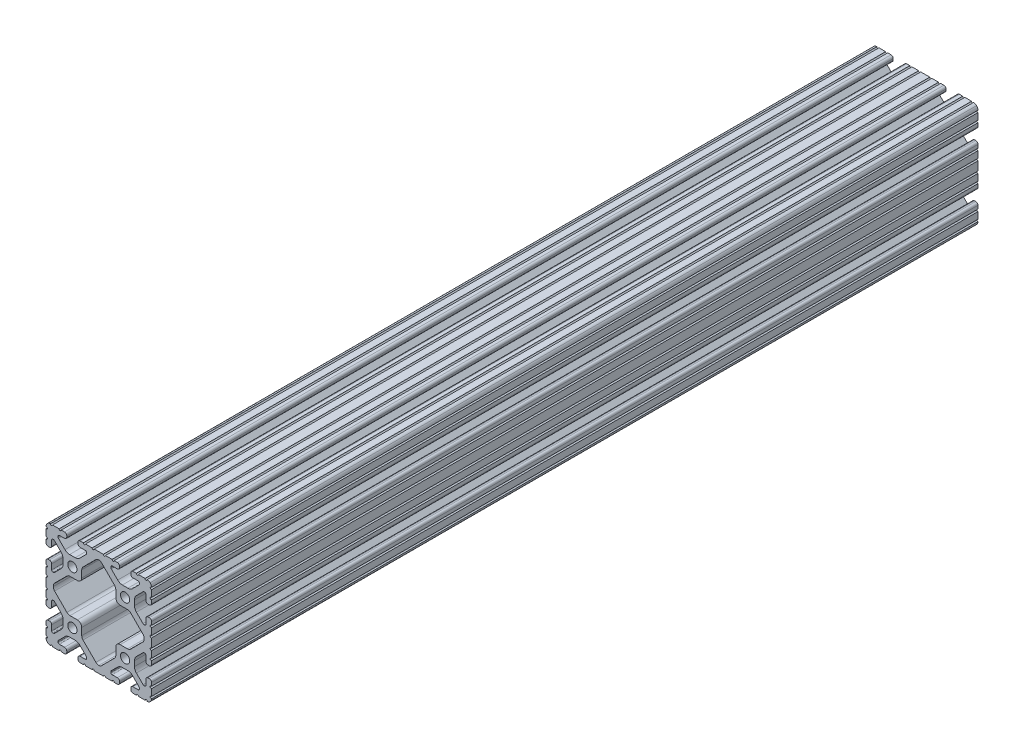
from build123d import *

# Parameters (mm, degrees)
SKETCH1_R           = 3.3274
BOSS_EXTRUDE1_DEPTH = 298.45


with BuildPart() as part:
    # Sketch1 → Boss-Extrude1 (new, symmetric)
    with BuildSketch(Plane.XY):
        with BuildLine():
            Line((-4.777313069, 38.1), (-9.605274992, 38.1))
            ThreePointArc((-9.605274992, 38.1), (-10.367071033, 37.320370693), (-11.128867074, 38.1))
            Line((-11.128867074, 38.1), (-13.4112, 38.1))
            ThreePointArc((-13.4112, 38.1), (-14.524751759, 37.638751759), (-14.986, 36.5252))
            Line((-14.986, 36.5252), (-14.986, 35.6108))
            ThreePointArc((-14.986, 35.6108), (-14.524751759, 34.497248241), (-13.4112, 34.036))
            Line((-13.4112, 34.036), (-9.652, 34.036))
            ThreePointArc((-9.652, 34.036), (-9.023382072, 33.775617928), (-8.763, 33.147))
            Line((-8.763, 33.147), (-8.763, 32.493548179))
            ThreePointArc((-8.763, 32.493548179), (-8.830670886, 32.153343113), (-9.023381298, 31.864931024))
            Line((-9.023381298, 31.864931024), (-13.690712501, 27.197588341))
            ThreePointArc((-13.690712501, 27.197588341), (-15.231659955, 26.167958114), (-17.049332421, 25.8064))
            Line((-17.049332421, 25.8064), (-21.050667579, 25.8064))
            ThreePointArc((-21.050667579, 25.8064), (-22.868340045, 26.167958114), (-24.409287499, 27.197588341))
            Line((-24.409287499, 27.197588341), (-29.100231244, 31.888543625))
            ThreePointArc((-29.100231244, 31.888543625), (-29.326675076, 32.273872751), (-29.337, 32.720693454))
            Line((-29.337, 32.720693454), (-29.337, 33.147))
            ThreePointArc((-29.337, 33.147), (-29.076617928, 33.775617928), (-28.448, 34.036))
            Line((-28.448, 34.036), (-24.6888, 34.036))
            ThreePointArc((-24.6888, 34.036), (-23.575248241, 34.497248241), (-23.114, 35.6108))
            Line((-23.114, 35.6108), (-23.114, 36.5252))
            ThreePointArc((-23.114, 36.5252), (-23.575248241, 37.638751759), (-24.6888, 38.1))
            Line((-24.6888, 38.1), (-27.077211227, 38.1))
            ThreePointArc((-27.077211227, 38.1), (-27.839158581, 37.32021942), (-28.601105935, 38.1))
            Line((-28.601105935, 38.1), (-33.428778994, 38.1))
            ThreePointArc((-33.428778994, 38.1), (-34.190730434, 37.320215335), (-34.952681874, 38.1))
            ThreePointArc((-34.952681874, 38.1), (-36.106286572, 37.843374398), (-37.086123144, 37.182631793))
            ThreePointArc((-37.086123144, 37.182631793), (-37.837757813, 36.120195002), (-38.1, 34.845457521))
            ThreePointArc((-38.1, 34.845457521), (-37.141472621, 34.109236774), (-38.1, 33.373016026))
            Line((-38.1, 33.373016026), (-38.1, 28.545258062))
            ThreePointArc((-38.1, 28.545258062), (-37.117780706, 27.7845421), (-38.1, 27.023826138))
            Line((-38.1, 27.023826138), (-38.1, 24.630195866))
            ThreePointArc((-38.1, 24.630195866), (-37.638751813, 23.516644236), (-36.525200183, 23.055396049))
            Line((-36.525200183, 23.055396049), (-35.6108, 23.055396049))
            ThreePointArc((-35.6108, 23.055396049), (-34.497248241, 23.51664429), (-34.036, 24.630196049))
            Line((-34.036, 24.630196049), (-34.036, 28.448))
            ThreePointArc((-34.036, 28.448), (-33.775617928, 29.076617928), (-33.147, 29.337))
            Line((-33.147, 29.337), (-32.664287242, 29.337))
            ThreePointArc((-32.664287242, 29.337), (-32.324081166, 29.269328695), (-32.03566854, 29.076617155))
            Line((-32.03566854, 29.076617155), (-27.19758008, 24.238516795))
            ThreePointArc((-27.19758008, 24.238516795), (-26.167955879, 22.697572205), (-25.8064, 20.879905136))
            Line((-25.8064, 20.879905136), (-25.8064, 17.220094864))
            ThreePointArc((-25.8064, 17.220094864), (-26.167955879, 15.402427795), (-27.19758008, 13.861483205))
            Line((-27.19758008, 13.861483205), (-31.948944541, 9.110107057))
            ThreePointArc((-31.948944541, 9.110107057), (-32.333417096, 8.853210196), (-32.786933649, 8.763))
            Line((-32.786933649, 8.763), (-33.060275787, 8.763))
            ThreePointArc((-33.060275787, 8.763), (-33.750216995, 9.048783005), (-34.036, 9.738724213))
            Line((-34.036, 9.738724213), (-34.036, 13.469803585))
            ThreePointArc((-34.036, 13.469803585), (-34.497248348, 14.583355603), (-35.610800366, 15.044603951))
            Line((-35.610800366, 15.044603951), (-36.5252, 15.044603951))
            ThreePointArc((-36.5252, 15.044603951), (-37.638751759, 14.58335571), (-38.1, 13.469803951))
            Line((-38.1, 13.469803951), (-38.1, 11.075039289))
            ThreePointArc((-38.1, 11.075039289), (-37.117000248, 10.313517272), (-38.1, 9.551995255))
            Line((-38.1, 9.551995255), (-38.1, 4.723759308))
            ThreePointArc((-38.1, 4.723759308), (-37.117000248, 3.962237292), (-38.1, 3.200715275))
            Line((-38.1, 3.200715275), (-38.1, -3.200715275))
            ThreePointArc((-38.1, -3.200715275), (-37.117000248, -3.962237292), (-38.1, -4.723759308))
            Line((-38.1, -4.723759308), (-38.1, -9.551995255))
            ThreePointArc((-38.1, -9.551995255), (-37.117000248, -10.313517272), (-38.1, -11.075039289))
            Line((-38.1, -11.075039289), (-38.1, -13.469803951))
            ThreePointArc((-38.1, -13.469803951), (-37.638751759, -14.58335571), (-36.5252, -15.044603951))
            Line((-36.5252, -15.044603951), (-35.610800366, -15.044603951))
            ThreePointArc((-35.610800366, -15.044603951), (-34.497248348, -14.583355603), (-34.036, -13.469803585))
            Line((-34.036, -13.469803585), (-34.036, -9.738724213))
            ThreePointArc((-34.036, -9.738724213), (-33.750216995, -9.048783005), (-33.060275787, -8.763))
            Line((-33.060275787, -8.763), (-32.786933649, -8.763))
            ThreePointArc((-32.786933649, -8.763), (-32.333417096, -8.853210196), (-31.948944541, -9.110107057))
            Line((-31.948944541, -9.110107057), (-27.19758008, -13.861483205))
            ThreePointArc((-27.19758008, -13.861483205), (-26.167955879, -15.402427795), (-25.8064, -17.220094864))
            Line((-25.8064, -17.220094864), (-25.8064, -20.879905136))
            ThreePointArc((-25.8064, -20.879905136), (-26.167955879, -22.697572205), (-27.19758008, -24.238516795))
            Line((-27.19758008, -24.238516795), (-32.03566854, -29.076617155))
            ThreePointArc((-32.03566854, -29.076617155), (-32.324081166, -29.269328695), (-32.664287242, -29.337))
            Line((-32.664287242, -29.337), (-33.147, -29.337))
            ThreePointArc((-33.147, -29.337), (-33.775617928, -29.076617928), (-34.036, -28.448))
            Line((-34.036, -28.448), (-34.036, -24.630196049))
            ThreePointArc((-34.036, -24.630196049), (-34.497248241, -23.51664429), (-35.6108, -23.055396049))
            Line((-35.6108, -23.055396049), (-36.525200183, -23.055396049))
            ThreePointArc((-36.525200183, -23.055396049), (-37.638751813, -23.516644236), (-38.1, -24.630195866))
            Line((-38.1, -24.630195866), (-38.1, -27.023826138))
            ThreePointArc((-38.1, -27.023826138), (-37.117780706, -27.7845421), (-38.1, -28.545258062))
            Line((-38.1, -28.545258062), (-38.1, -33.373016026))
            ThreePointArc((-38.1, -33.373016026), (-37.141472621, -34.109236774), (-38.1, -34.845457521))
            ThreePointArc((-38.1, -34.845457521), (-37.837757813, -36.120195002), (-37.086123144, -37.182631793))
            ThreePointArc((-37.086123144, -37.182631793), (-36.106286572, -37.843374398), (-34.952681874, -38.1))
            ThreePointArc((-34.952681874, -38.1), (-34.190730434, -37.320215335), (-33.428778994, -38.1))
            Line((-33.428778994, -38.1), (-28.601105935, -38.1))
            ThreePointArc((-28.601105935, -38.1), (-27.839158581, -37.32021942), (-27.077211227, -38.1))
            Line((-27.077211227, -38.1), (-24.6888, -38.1))
            ThreePointArc((-24.6888, -38.1), (-23.575248241, -37.638751759), (-23.114, -36.5252))
            Line((-23.114, -36.5252), (-23.114, -35.6108))
            ThreePointArc((-23.114, -35.6108), (-23.575248241, -34.497248241), (-24.6888, -34.036))
            Line((-24.6888, -34.036), (-28.448, -34.036))
            ThreePointArc((-28.448, -34.036), (-29.076617928, -33.775617928), (-29.337, -33.147))
            Line((-29.337, -33.147), (-29.337, -32.720693454))
            ThreePointArc((-29.337, -32.720693454), (-29.326675076, -32.273872751), (-29.100231244, -31.888543625))
            Line((-29.100231244, -31.888543625), (-24.409287499, -27.197588341))
            ThreePointArc((-24.409287499, -27.197588341), (-22.868340045, -26.167958114), (-21.050667579, -25.8064))
            Line((-21.050667579, -25.8064), (-17.049332421, -25.8064))
            ThreePointArc((-17.049332421, -25.8064), (-15.231659955, -26.167958114), (-13.690712501, -27.197588341))
            Line((-13.690712501, -27.197588341), (-9.023381298, -31.864931024))
            ThreePointArc((-9.023381298, -31.864931024), (-8.830670886, -32.153343113), (-8.763, -32.493548179))
            Line((-8.763, -32.493548179), (-8.763, -33.147))
            ThreePointArc((-8.763, -33.147), (-9.023382072, -33.775617928), (-9.652, -34.036))
            Line((-9.652, -34.036), (-13.4112, -34.036))
            ThreePointArc((-13.4112, -34.036), (-14.524751759, -34.497248241), (-14.986, -35.6108))
            Line((-14.986, -35.6108), (-14.986, -36.5252))
            ThreePointArc((-14.986, -36.5252), (-14.524751759, -37.638751759), (-13.4112, -38.1))
            Line((-13.4112, -38.1), (-11.128867074, -38.1))
            ThreePointArc((-11.128867074, -38.1), (-10.367071033, -37.320370693), (-9.605274992, -38.1))
            Line((-9.605274992, -38.1), (-4.777313069, -38.1))
            ThreePointArc((-4.777313069, -38.1), (-4.015517029, -37.320370693), (-3.253720988, -38.1))
            Line((-3.253720988, -38.1), (3.253720988, -38.1))
            ThreePointArc((3.253720988, -38.1), (4.015517029, -37.320370693), (4.777313069, -38.1))
            Line((4.777313069, -38.1), (9.605274992, -38.1))
            ThreePointArc((9.605274992, -38.1), (10.367071033, -37.320370693), (11.128867074, -38.1))
            Line((11.128867074, -38.1), (13.4112, -38.1))
            ThreePointArc((13.4112, -38.1), (14.524751759, -37.638751759), (14.986, -36.5252))
            Line((14.986, -36.5252), (14.986, -35.6108))
            ThreePointArc((14.986, -35.6108), (14.524751759, -34.497248241), (13.4112, -34.036))
            Line((13.4112, -34.036), (9.652, -34.036))
            ThreePointArc((9.652, -34.036), (9.023382072, -33.775617928), (8.763, -33.147))
            Line((8.763, -33.147), (8.763, -32.493548179))
            ThreePointArc((8.763, -32.493548179), (8.830670886, -32.153343113), (9.023381298, -31.864931024))
            Line((9.023381298, -31.864931024), (13.690712501, -27.197588341))
            ThreePointArc((13.690712501, -27.197588341), (15.231659955, -26.167958114), (17.049332421, -25.8064))
            Line((17.049332421, -25.8064), (21.050667579, -25.8064))
            ThreePointArc((21.050667579, -25.8064), (22.868340045, -26.167958114), (24.409287499, -27.197588341))
            Line((24.409287499, -27.197588341), (29.100231244, -31.888543625))
            ThreePointArc((29.100231244, -31.888543625), (29.326675076, -32.273872751), (29.337, -32.720693454))
            Line((29.337, -32.720693454), (29.337, -33.147))
            ThreePointArc((29.337, -33.147), (29.076617928, -33.775617928), (28.448, -34.036))
            Line((28.448, -34.036), (24.6888, -34.036))
            ThreePointArc((24.6888, -34.036), (23.575248241, -34.497248241), (23.114, -35.6108))
            Line((23.114, -35.6108), (23.114, -36.5252))
            ThreePointArc((23.114, -36.5252), (23.575248241, -37.638751759), (24.6888, -38.1))
            Line((24.6888, -38.1), (27.077211227, -38.1))
            ThreePointArc((27.077211227, -38.1), (27.839158581, -37.32021942), (28.601105935, -38.1))
            Line((28.601105935, -38.1), (33.428778994, -38.1))
            ThreePointArc((33.428778994, -38.1), (34.190730434, -37.320215335), (34.952681874, -38.1))
            ThreePointArc((34.952681874, -38.1), (36.106286572, -37.843374398), (37.086123144, -37.182631793))
            ThreePointArc((37.086123144, -37.182631793), (37.837757813, -36.120195002), (38.1, -34.845457521))
            ThreePointArc((38.1, -34.845457521), (37.141472621, -34.109236774), (38.1, -33.373016026))
            Line((38.1, -33.373016026), (38.1, -28.545258062))
            ThreePointArc((38.1, -28.545258062), (37.117780706, -27.7845421), (38.1, -27.023826138))
            Line((38.1, -27.023826138), (38.1, -24.630195866))
            ThreePointArc((38.1, -24.630195866), (37.638751813, -23.516644236), (36.525200183, -23.055396049))
            Line((36.525200183, -23.055396049), (35.6108, -23.055396049))
            ThreePointArc((35.6108, -23.055396049), (34.497248241, -23.51664429), (34.036, -24.630196049))
            Line((34.036, -24.630196049), (34.036, -28.448))
            ThreePointArc((34.036, -28.448), (33.775617928, -29.076617928), (33.147, -29.337))
            Line((33.147, -29.337), (32.664287242, -29.337))
            ThreePointArc((32.664287242, -29.337), (32.324081166, -29.269328695), (32.03566854, -29.076617155))
            Line((32.03566854, -29.076617155), (27.19758008, -24.238516795))
            ThreePointArc((27.19758008, -24.238516795), (26.167955879, -22.697572205), (25.8064, -20.879905136))
            Line((25.8064, -20.879905136), (25.8064, -17.220094864))
            ThreePointArc((25.8064, -17.220094864), (26.167955879, -15.402427795), (27.19758008, -13.861483205))
            Line((27.19758008, -13.861483205), (31.948944541, -9.110107057))
            ThreePointArc((31.948944541, -9.110107057), (32.333417096, -8.853210196), (32.786933649, -8.763))
            Line((32.786933649, -8.763), (33.060275787, -8.763))
            ThreePointArc((33.060275787, -8.763), (33.750216995, -9.048783005), (34.036, -9.738724213))
            Line((34.036, -9.738724213), (34.036, -13.469803585))
            ThreePointArc((34.036, -13.469803585), (34.497248348, -14.583355603), (35.610800366, -15.044603951))
            Line((35.610800366, -15.044603951), (36.5252, -15.044603951))
            ThreePointArc((36.5252, -15.044603951), (37.638751759, -14.58335571), (38.1, -13.469803951))
            Line((38.1, -13.469803951), (38.1, -11.075039289))
            ThreePointArc((38.1, -11.075039289), (37.117000248, -10.313517272), (38.1, -9.551995255))
            Line((38.1, -9.551995255), (38.1, -4.723759308))
            ThreePointArc((38.1, -4.723759308), (37.117000248, -3.962237292), (38.1, -3.200715275))
            Line((38.1, -3.200715275), (38.1, 3.200715275))
            ThreePointArc((38.1, 3.200715275), (37.117000248, 3.962237292), (38.1, 4.723759308))
            Line((38.1, 4.723759308), (38.1, 9.551995255))
            ThreePointArc((38.1, 9.551995255), (37.117000248, 10.313517272), (38.1, 11.075039289))
            Line((38.1, 11.075039289), (38.1, 13.469803951))
            ThreePointArc((38.1, 13.469803951), (37.638751759, 14.58335571), (36.5252, 15.044603951))
            Line((36.5252, 15.044603951), (35.610800366, 15.044603951))
            ThreePointArc((35.610800366, 15.044603951), (34.497248348, 14.583355603), (34.036, 13.469803585))
            Line((34.036, 13.469803585), (34.036, 9.738724213))
            ThreePointArc((34.036, 9.738724213), (33.750216995, 9.048783005), (33.060275787, 8.763))
            Line((33.060275787, 8.763), (32.786933649, 8.763))
            ThreePointArc((32.786933649, 8.763), (32.333417096, 8.853210196), (31.948944541, 9.110107057))
            Line((31.948944541, 9.110107057), (27.19758008, 13.861483205))
            ThreePointArc((27.19758008, 13.861483205), (26.167955879, 15.402427795), (25.8064, 17.220094864))
            Line((25.8064, 17.220094864), (25.8064, 20.879905136))
            ThreePointArc((25.8064, 20.879905136), (26.167955879, 22.697572205), (27.19758008, 24.238516795))
            Line((27.19758008, 24.238516795), (32.03566854, 29.076617155))
            ThreePointArc((32.03566854, 29.076617155), (32.324081166, 29.269328695), (32.664287242, 29.337))
            Line((32.664287242, 29.337), (33.147, 29.337))
            ThreePointArc((33.147, 29.337), (33.775617928, 29.076617928), (34.036, 28.448))
            Line((34.036, 28.448), (34.036, 24.630196049))
            ThreePointArc((34.036, 24.630196049), (34.497248241, 23.51664429), (35.6108, 23.055396049))
            Line((35.6108, 23.055396049), (36.525200183, 23.055396049))
            ThreePointArc((36.525200183, 23.055396049), (37.638751813, 23.516644236), (38.1, 24.630195866))
            Line((38.1, 24.630195866), (38.1, 27.023826138))
            ThreePointArc((38.1, 27.023826138), (37.117780706, 27.7845421), (38.1, 28.545258062))
            Line((38.1, 28.545258062), (38.1, 33.373016026))
            ThreePointArc((38.1, 33.373016026), (37.141472621, 34.109236774), (38.1, 34.845457521))
            ThreePointArc((38.1, 34.845457521), (37.837757813, 36.120195002), (37.086123144, 37.182631793))
            ThreePointArc((37.086123144, 37.182631793), (36.106286572, 37.843374398), (34.952681874, 38.1))
            ThreePointArc((34.952681874, 38.1), (34.190730434, 37.320215335), (33.428778994, 38.1))
            Line((33.428778994, 38.1), (28.601105935, 38.1))
            ThreePointArc((28.601105935, 38.1), (27.839158581, 37.32021942), (27.077211227, 38.1))
            Line((27.077211227, 38.1), (24.6888, 38.1))
            ThreePointArc((24.6888, 38.1), (23.575248241, 37.638751759), (23.114, 36.5252))
            Line((23.114, 36.5252), (23.114, 35.6108))
            ThreePointArc((23.114, 35.6108), (23.575248241, 34.497248241), (24.6888, 34.036))
            Line((24.6888, 34.036), (28.448, 34.036))
            ThreePointArc((28.448, 34.036), (29.076617928, 33.775617928), (29.337, 33.147))
            Line((29.337, 33.147), (29.337, 32.720693454))
            ThreePointArc((29.337, 32.720693454), (29.326675076, 32.273872751), (29.100231244, 31.888543625))
            Line((29.100231244, 31.888543625), (24.409287499, 27.197588341))
            ThreePointArc((24.409287499, 27.197588341), (22.868340045, 26.167958114), (21.050667579, 25.8064))
            Line((21.050667579, 25.8064), (17.049332421, 25.8064))
            ThreePointArc((17.049332421, 25.8064), (15.231659955, 26.167958114), (13.690712501, 27.197588341))
            Line((13.690712501, 27.197588341), (9.023381298, 31.864931024))
            ThreePointArc((9.023381298, 31.864931024), (8.830670886, 32.153343113), (8.763, 32.493548179))
            Line((8.763, 32.493548179), (8.763, 33.147))
            ThreePointArc((8.763, 33.147), (9.023382072, 33.775617928), (9.652, 34.036))
            Line((9.652, 34.036), (13.4112, 34.036))
            ThreePointArc((13.4112, 34.036), (14.524751759, 34.497248241), (14.986, 35.6108))
            Line((14.986, 35.6108), (14.986, 36.5252))
            ThreePointArc((14.986, 36.5252), (14.524751759, 37.638751759), (13.4112, 38.1))
            Line((13.4112, 38.1), (11.128867074, 38.1))
            ThreePointArc((11.128867074, 38.1), (10.367071033, 37.320370693), (9.605274992, 38.1))
            Line((9.605274992, 38.1), (4.777313069, 38.1))
            ThreePointArc((4.777313069, 38.1), (4.015517029, 37.320370693), (3.253720988, 38.1))
            Line((3.253720988, 38.1), (-3.253720988, 38.1))
            ThreePointArc((-3.253720988, 38.1), (-4.015517029, 37.320370693), (-4.777313069, 38.1))
        make_face()
        with Locations((-19.05, 19.05)):
            Circle(SKETCH1_R, mode=Mode.SUBTRACT)
        with Locations((-19.05, -19.05)):
            Circle(SKETCH1_R, mode=Mode.SUBTRACT)
        with Locations((19.05, -19.05)):
            Circle(SKETCH1_R, mode=Mode.SUBTRACT)
        with Locations((19.05, 19.05)):
            Circle(SKETCH1_R, mode=Mode.SUBTRACT)
        with BuildLine():
            Line((-11.363666791, -22.843321003), (-2.051515952, -32.155494748))
            ThreePointArc((-2.051515952, -32.155494748), (-1.11031328, -32.786013752), (0, -33.011005091))
            ThreePointArc((0, -33.011005091), (1.11031328, -32.786013752), (2.051515952, -32.155494748))
            Line((2.051515952, -32.155494748), (11.363666791, -22.843321003))
            ThreePointArc((11.363666791, -22.843321003), (12.051918263, -21.813277828), (12.2936, -20.598259734))
            Line((12.2936, -20.598259734), (12.2936, -15.4686))
            ThreePointArc((12.2936, -15.4686), (13.22353597, -13.22353597), (15.4686, -12.2936))
            Line((15.4686, -12.2936), (20.769026744, -12.2936))
            ThreePointArc((20.769026744, -12.2936), (21.984048446, -12.051916769), (23.014093535, -11.363661269))
            Line((23.014093535, -11.363661269), (31.902125566, -2.475607377))
            ThreePointArc((31.902125566, -2.475607377), (32.607298578, -1.335259481), (32.728725173, 0))
            ThreePointArc((32.728725173, 0), (32.607298578, 1.335259481), (31.902125566, 2.475607377))
            Line((31.902125566, 2.475607377), (23.014093535, 11.363661269))
            ThreePointArc((23.014093535, 11.363661269), (21.984048446, 12.051916769), (20.769026744, 12.2936))
            Line((20.769026744, 12.2936), (15.4686, 12.2936))
            ThreePointArc((15.4686, 12.2936), (13.22353597, 13.22353597), (12.2936, 15.4686))
            Line((12.2936, 15.4686), (12.2936, 20.598259734))
            ThreePointArc((12.2936, 20.598259734), (12.051918263, 21.813277828), (11.363666791, 22.843321003))
            Line((11.363666791, 22.843321003), (2.051515952, 32.155494748))
            ThreePointArc((2.051515952, 32.155494748), (1.11031328, 32.786013752), (0, 33.011005091))
            ThreePointArc((0, 33.011005091), (-1.11031328, 32.786013752), (-2.051515952, 32.155494748))
            Line((-2.051515952, 32.155494748), (-11.363666791, 22.843321003))
            ThreePointArc((-11.363666791, 22.843321003), (-12.051918263, 21.813277828), (-12.2936, 20.598259734))
            Line((-12.2936, 20.598259734), (-12.2936, 15.4686))
            ThreePointArc((-12.2936, 15.4686), (-13.22353597, 13.22353597), (-15.4686, 12.2936))
            Line((-15.4686, 12.2936), (-20.769026744, 12.2936))
            ThreePointArc((-20.769026744, 12.2936), (-21.984048446, 12.051916769), (-23.014093535, 11.363661269))
            Line((-23.014093535, 11.363661269), (-31.902125566, 2.475607377))
            ThreePointArc((-31.902125566, 2.475607377), (-32.607298578, 1.335259481), (-32.728725173, 0))
            ThreePointArc((-32.728725173, 0), (-32.607298578, -1.335259481), (-31.902125566, -2.475607377))
            Line((-31.902125566, -2.475607377), (-23.014093535, -11.363661269))
            ThreePointArc((-23.014093535, -11.363661269), (-21.984048446, -12.051916769), (-20.769026744, -12.2936))
            Line((-20.769026744, -12.2936), (-15.4686, -12.2936))
            ThreePointArc((-15.4686, -12.2936), (-13.22353597, -13.22353597), (-12.2936, -15.4686))
            Line((-12.2936, -15.4686), (-12.2936, -20.598259734))
            ThreePointArc((-12.2936, -20.598259734), (-12.051918263, -21.813277828), (-11.363666791, -22.843321003))
        make_face(mode=Mode.SUBTRACT)
    extrude(amount=BOSS_EXTRUDE1_DEPTH, both=True)


solid = part.part
